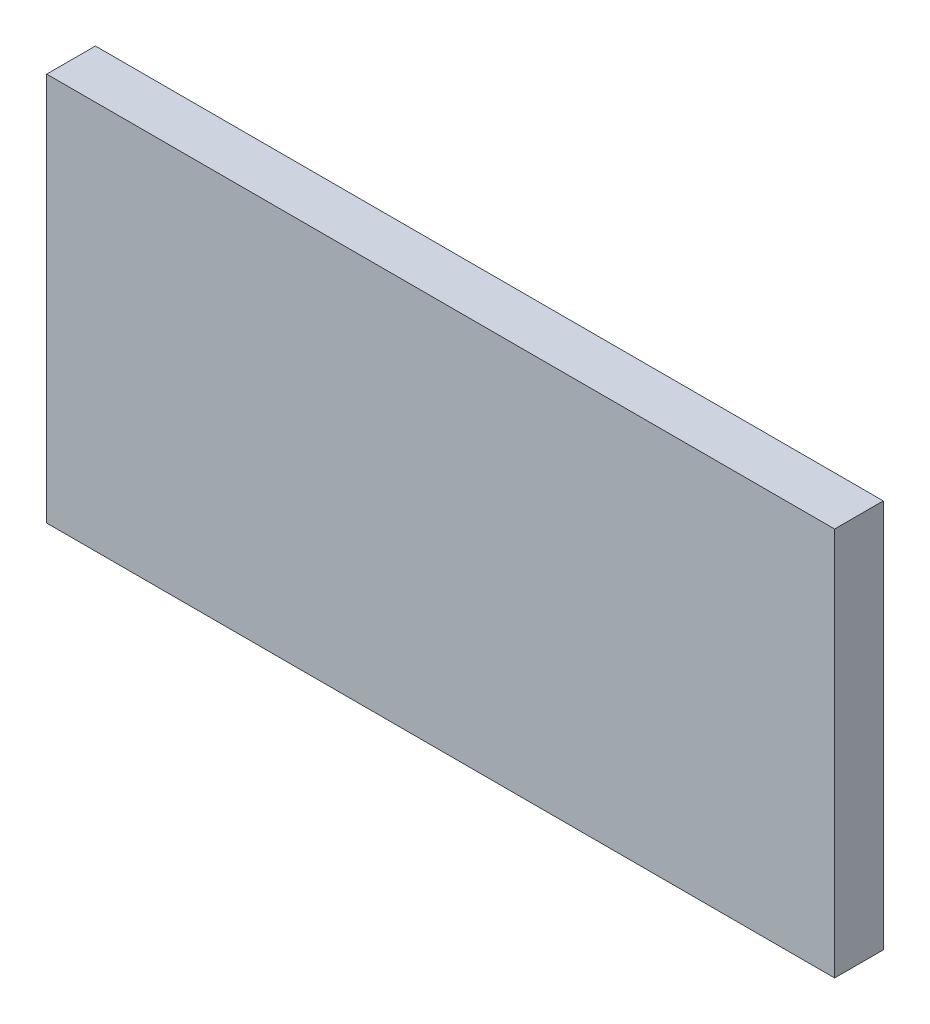
from build123d import *

# Parameters (mm, degrees)
SKETCH1_W           = 308.405777754
SKETCH1_H           = 152.207057826
BOSS_EXTRUDE2_DEPTH = 19.05


with BuildPart() as part:
    # Sketch1 → Boss-Extrude2 (new body)
    with BuildSketch(Plane.XY.offset(-312.283340188)):
        with Locations((260.830529276, 37.750794274)):
            Rectangle(SKETCH1_W, SKETCH1_H)
    extrude(amount=BOSS_EXTRUDE2_DEPTH)


solid = part.part
